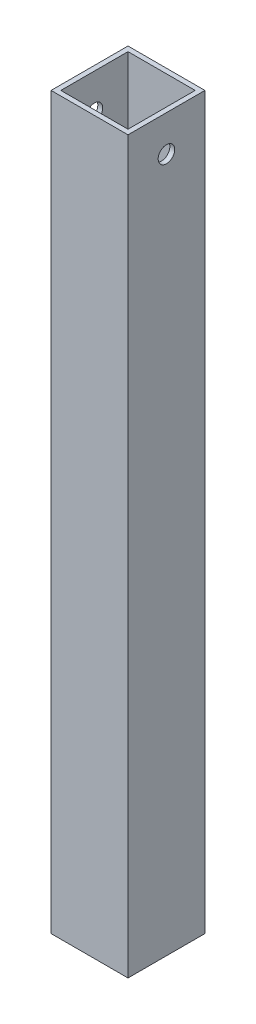
from build123d import *

# Parameters (mm, degrees)
SKETCH1_W           = 15.8
SKETCH1_H           = 15.8
SKETCH1_W_2         = 13.8
SKETCH1_H_2         = 13.8
BOSS_EXTRUDE1_DEPTH = 150
SKETCH2_R           = 1.7
CUT_EXTRUDE1_DEPTH  = 152.036584972


with BuildPart() as part:
    # Sketch1 → Boss-Extrude1 (new body)
    with BuildSketch(Plane(origin=(0, 0, 0), x_dir=(1, 0, 0), z_dir=(0, 1, 0))):
        Rectangle(SKETCH1_W, SKETCH1_H)
        Rectangle(SKETCH1_W_2, SKETCH1_H_2, mode=Mode.SUBTRACT)
    extrude(amount=BOSS_EXTRUDE1_DEPTH)

    # Sketch2 → Cut-Extrude1 (cut, through all)
    with BuildSketch(Plane.ZY.offset(7.9)):
        with Locations((0, 142.6)):
            Circle(SKETCH2_R)
    extrude(amount=-CUT_EXTRUDE1_DEPTH, mode=Mode.SUBTRACT)


solid = part.part
